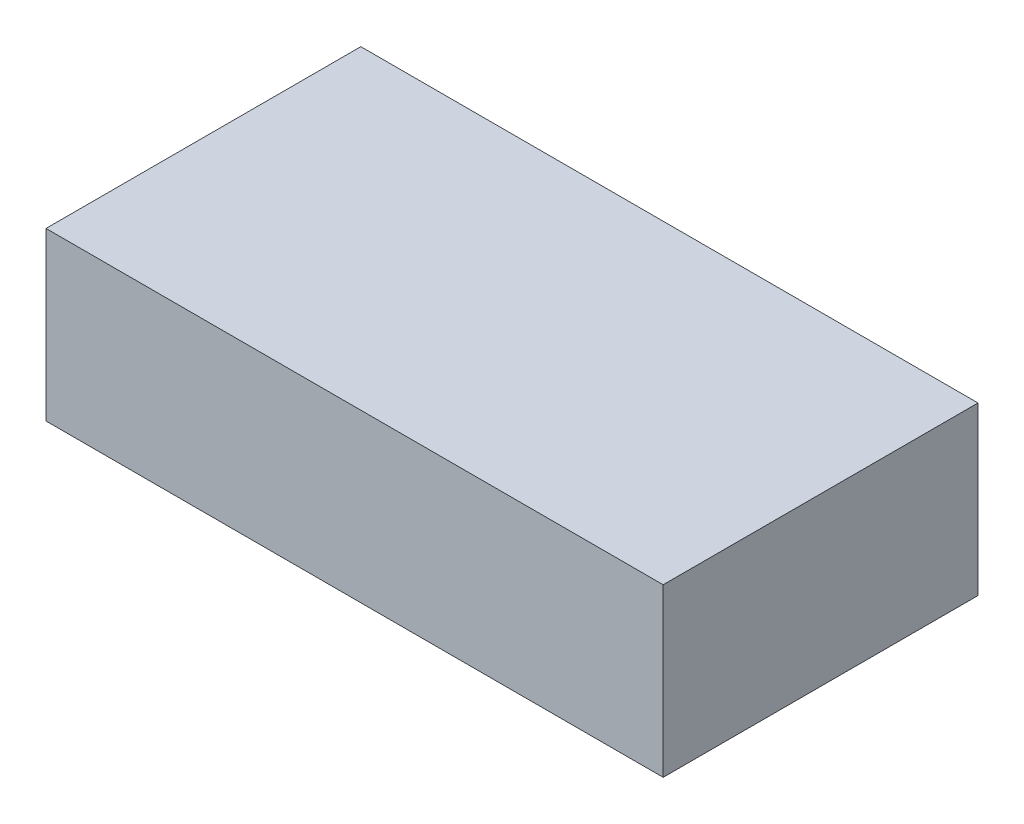
from build123d import *

# Parameters (mm, degrees)
SKETCH1_W           = 296
SKETCH1_H           = 151
BOSS_EXTRUDE1_DEPTH = 80


with BuildPart() as part:
    # Sketch1 → Boss-Extrude1 (new body)
    with BuildSketch(Plane(origin=(0, 0, 0), x_dir=(1, 0, 0), z_dir=(0, 1, 0))):
        with Locations((-98.666666667, 35.159409695)):
            Rectangle(SKETCH1_W, SKETCH1_H)
    extrude(amount=BOSS_EXTRUDE1_DEPTH)


solid = part.part
